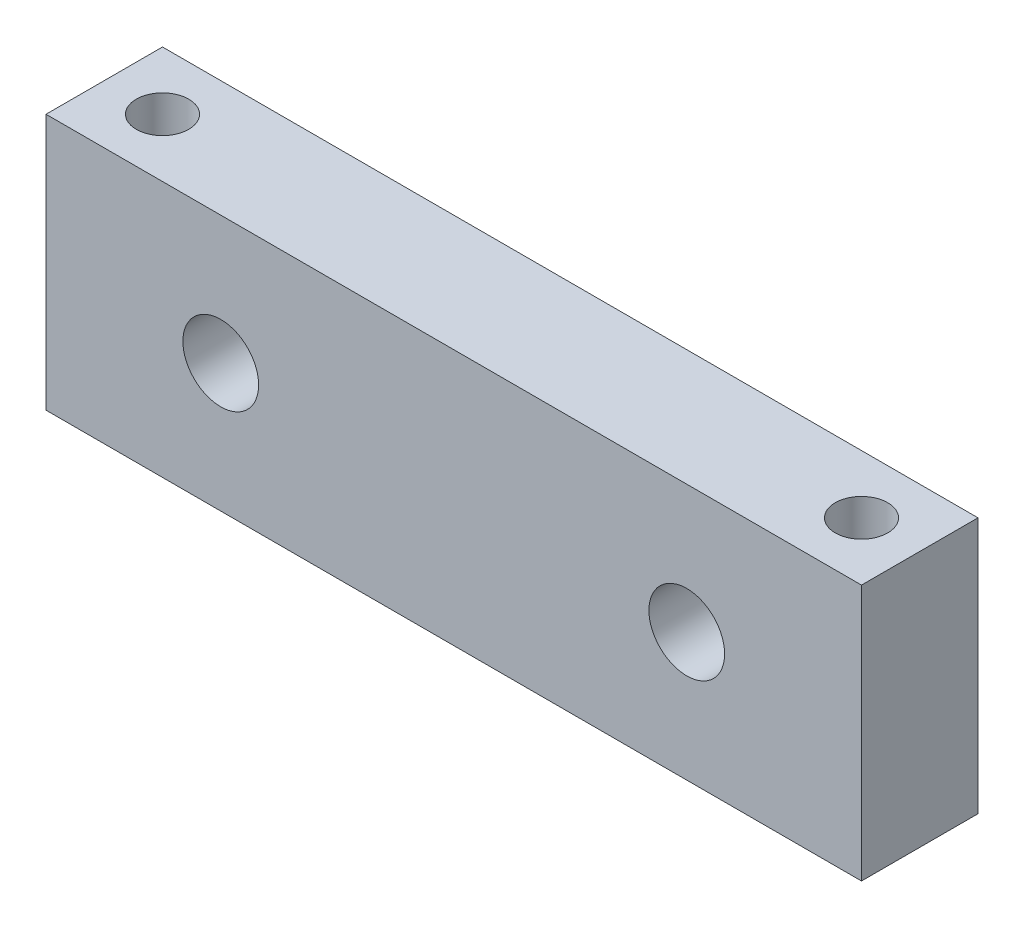
from build123d import *

# Parameters (mm, degrees)
SKETCH1_W           = 70
SKETCH1_H           = 22
BOSS_EXTRUDE1_DEPTH = 10
SKETCH2_R           = 2.25
CUT_EXTRUDE1_DEPTH  = 45
SKETCH3_R           = 3.25
CUT_EXTRUDE2_DEPTH  = 45
SKETCH4_R           = 5.199573864
SKETCH4_R_2         = 3.199573864
SKETCH4_R_3         = 5.25
SKETCH4_R_4         = 3.25
BOSS_EXTRUDE2_DEPTH = 4
SKETCH5_R           = 4
CUT_EXTRUDE3_DEPTH  = 4


with BuildPart() as part:
    # Sketch1 → Boss-Extrude1 (new body)
    with BuildSketch(Plane.XY):
        Rectangle(SKETCH1_W, SKETCH1_H)
    extrude(amount=BOSS_EXTRUDE1_DEPTH)

    # Sketch2 → Cut-Extrude1 (cut)
    with BuildSketch(Plane(origin=(0, 11, 0), x_dir=(1, 0, 0), z_dir=(0, 1, 0))):
        with Locations(Location((-30, -5, 0), (0, 0, 270))):
            Circle(SKETCH2_R)
        with Locations(Location((30, -5, 0), (0, 0, 270))):
            Circle(SKETCH2_R)
    extrude(amount=-CUT_EXTRUDE1_DEPTH, mode=Mode.SUBTRACT)

    # Sketch3 → Cut-Extrude2 (cut)
    with BuildSketch(Plane.XY.offset(10)):
        with Locations((20, 0)):
            Circle(SKETCH3_R)
        with Locations((-20, 0)):
            Circle(SKETCH3_R)
    extrude(amount=-CUT_EXTRUDE2_DEPTH, mode=Mode.SUBTRACT)

    # Sketch4 → Boss-Extrude2 (add)
    # profile 1 of 2: a face of its own
    with BuildSketch(Plane(origin=(0, 0, 0), x_dir=(-1, 0, 0), z_dir=(0, 0, -1))):
        with Locations((-20, 0)):
            Circle(SKETCH4_R)
        with Locations((-20, 0)):
            Circle(SKETCH4_R_2, mode=Mode.SUBTRACT)
    # profile 2 of 2: a face of its own
    with BuildSketch(Plane(origin=(0, 0, 0), x_dir=(-1, 0, 0), z_dir=(0, 0, -1))):
        with Locations((20, 0)):
            Circle(SKETCH4_R_3)
        with Locations(Location((20, 0, 0), (0, 0, 180))):
            Circle(SKETCH4_R_4, mode=Mode.SUBTRACT)
    extrude(amount=BOSS_EXTRUDE2_DEPTH)

    # Sketch5 → Cut-Extrude3 (cut)
    with BuildSketch(Plane.XZ.offset(11)):
        with Locations(Location((30, 5, 0), (0, 0, 270))):
            Circle(SKETCH5_R)
        with Locations(Location((-30, 5, 0), (0, 0, 270))):
            Circle(SKETCH5_R)
    extrude(amount=-CUT_EXTRUDE3_DEPTH, mode=Mode.SUBTRACT)


solid = part.part
